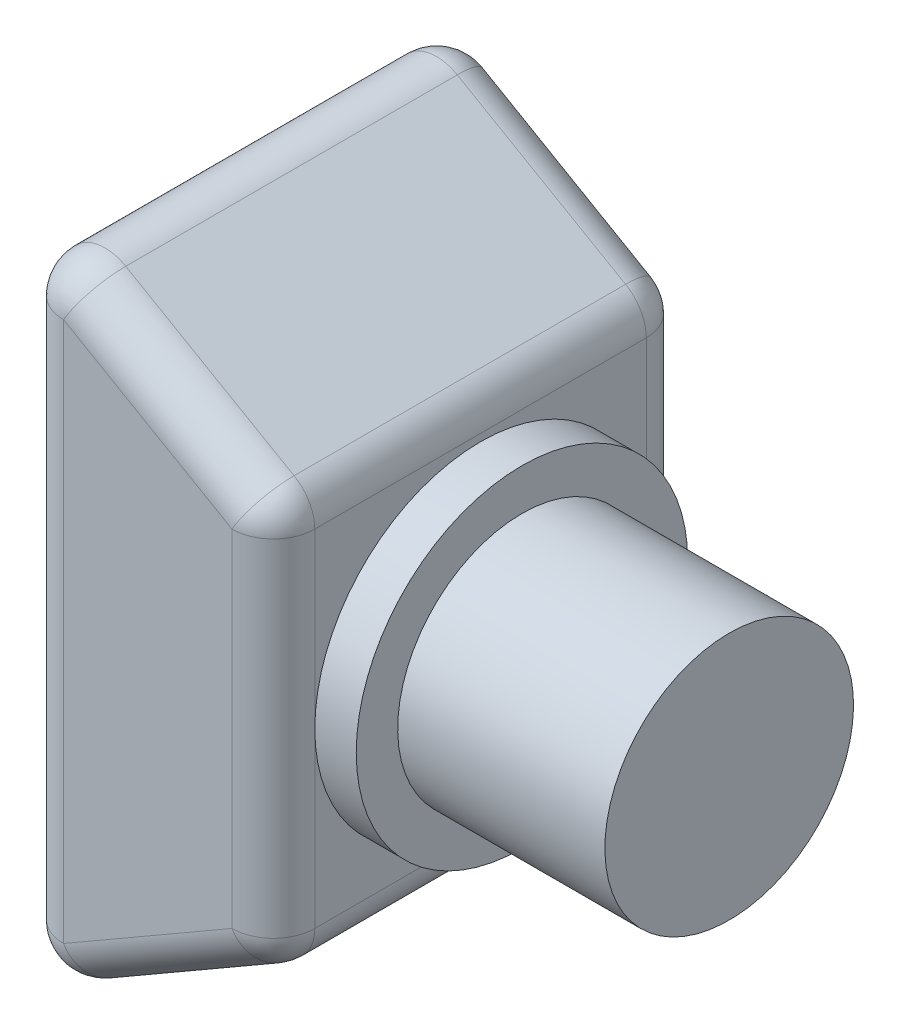
from build123d import *

# Parameters (mm, degrees)
Y_KSEKLIK_EKSTR_ZYON1_DEPTH = 10
RADYUS1_R                   = 1
RADYUS2_R                   = 1
IZIM2_R                     = 4
Y_KSEKLIK_EKSTR_ZYON2_DEPTH = 1
IZIM3_R                     = 3
Y_KSEKLIK_EKSTR_ZYON3_DEPTH = 5


with BuildPart() as part:
    # Çizim1 → Yükseklik-Ekstrüzyon1 (new body)
    with BuildSketch(Plane.XY):
        Polygon((0, -8.25), (0, 8.25), (6.062177826, 4.75), (6.062177826, -4.75), align=None)
    extrude(amount=Y_KSEKLIK_EKSTR_ZYON1_DEPTH)

    # Radyus1
    radyus1_edges = [part.edges().sort_by_distance(p)[0] for p in [
        (0, -8.25, 5),
        (0, 8.25, 5),
        (6.062177826, 4.75, 5),
        (6.062177826, -4.75, 5),
    ]]
    fillet(radyus1_edges, radius=RADYUS1_R)

    # Radyus2
    radyus2_edges = [part.edges().sort_by_distance(p)[0] for p in [
        (3.531088913, -6.211324865, 0),
        (3.531088913, -6.211324865, 10),
        (0, 0, 0),
        (3.531088913, 6.211324865, 0),
        (6.062177826, 0, 0),
        (0.5, 7.383974596, 0),
        (5.92820323, 4.672649731, 0),
        (5.92820323, -4.672649731, 0),
        (0.5, -7.383974596, 0),
        (0, 0, 10),
        (6.062177826, 0, 10),
        (3.531088913, 6.211324865, 10),
        (0.5, 7.383974596, 10),
        (5.92820323, 4.672649731, 10),
        (5.92820323, -4.672649731, 10),
        (0.5, -7.383974596, 10),
    ]]
    fillet(radyus2_edges, radius=RADYUS2_R)

    # Çizim2 → Yükseklik-Ekstrüzyon2 (add)
    with BuildSketch(Plane(origin=(6.062177826, 0, 0), x_dir=(0, 0, -1), z_dir=(1, 0, 0))):
        with Locations((-5, 0)):
            Circle(IZIM2_R)
    extrude(amount=Y_KSEKLIK_EKSTR_ZYON2_DEPTH)

    # Çizim3 → Yükseklik-Ekstrüzyon3 (add)
    with BuildSketch(Plane(origin=(7.062177826, 0, 0), x_dir=(0, 0, -1), z_dir=(1, 0, 0))):
        with Locations(Location((-5, 0, 0), (0, 0, 90))):
            Circle(IZIM3_R)
    extrude(amount=Y_KSEKLIK_EKSTR_ZYON3_DEPTH)


solid = part.part
